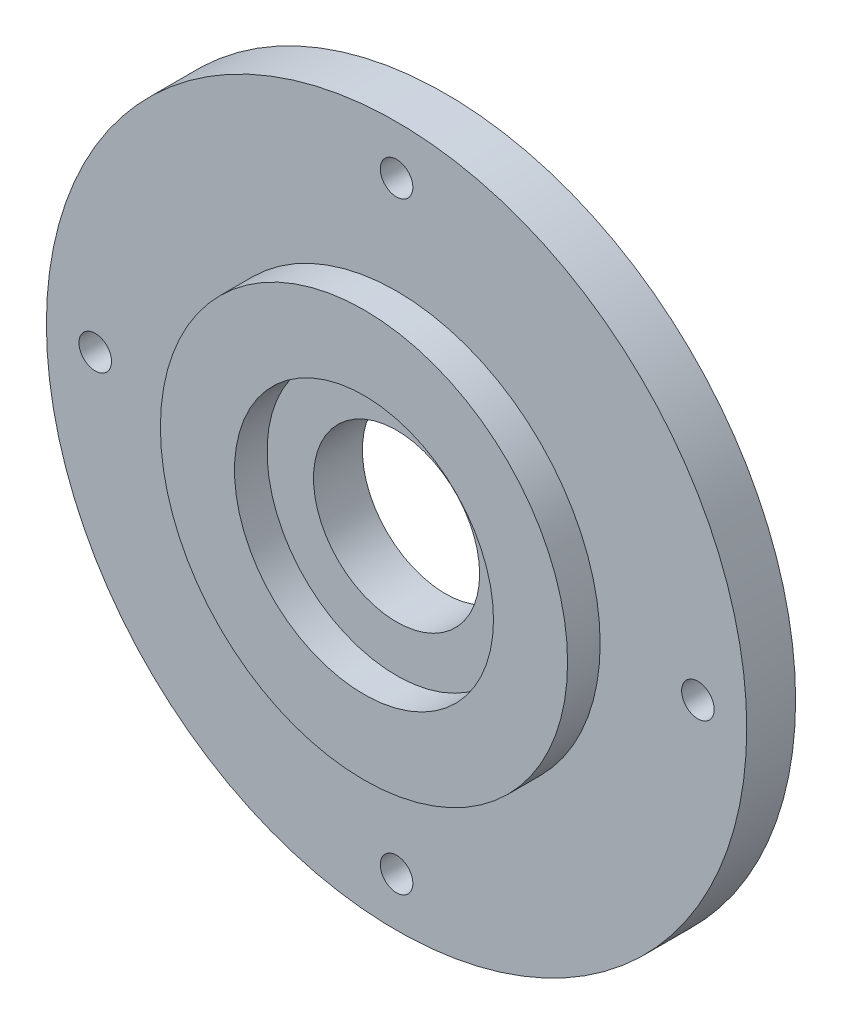
from build123d import *

# Parameters (mm, degrees)
SKETCH_1_R               = 41.5
SKETCH_1_R_2             = 2
SKETCH_1_R_3             = 10.2
EXTRUDE_1_DEPTH          = 6
CUT_EXTRUDE_1_DEPTH      = 59.99576256
CUT_EXTRUDE_1_DEPTH_BACK = 59.99576256
SKETCH_4_R               = 1.65
SKETCH_3_R               = 25
SKETCH_3_R_2             = 15.9
EXTRUDE_2_DEPTH          = 4
EXTRUDE_START            = -6
SKETCH_5_R               = 43
SKETCH_5_R_2             = 41.5
EXTRUDE_4_DEPTH          = 6


with BuildPart() as part:
    # 草图1 → 凸台-拉伸1 (new body)
    with BuildSketch(Plane.XY):
        Circle(SKETCH_1_R)
        with Locations((0, -37)):
            Circle(SKETCH_1_R_2, mode=Mode.SUBTRACT)
        with Locations((-37, 0)):
            Circle(SKETCH_1_R_2, mode=Mode.SUBTRACT)
        with Locations((0, 37)):
            Circle(SKETCH_1_R_2, mode=Mode.SUBTRACT)
        with Locations((37, 0)):
            Circle(SKETCH_1_R_2, mode=Mode.SUBTRACT)
        Circle(SKETCH_1_R_3, mode=Mode.SUBTRACT)
    extrude(amount=EXTRUDE_1_DEPTH)

    # 草图4 → 切除-拉伸1 (cut, two sides: drawn at the far end of the back side and taken through both)
    with BuildSketch(Plane(origin=(0, 0, 0), x_dir=(-1, 0, 0), z_dir=(0, 0, -1)).offset(-CUT_EXTRUDE_1_DEPTH_BACK)):
        with Locations((-19.798989873, 4.242640687)):
            Circle(SKETCH_4_R)
        with Locations((-4.242640687, 19.798989873)):
            Circle(SKETCH_4_R)
        with Locations((19.798989873, -4.242640687)):
            Circle(SKETCH_4_R)
        with Locations((4.242640687, -19.798989873)):
            Circle(SKETCH_4_R)
    extrude(amount=CUT_EXTRUDE_1_DEPTH + CUT_EXTRUDE_1_DEPTH_BACK, mode=Mode.SUBTRACT)

    # 草图3 → 凸台-拉伸2 (add)
    with BuildSketch(Plane.XY.offset(6)):
        Circle(SKETCH_3_R)
        Circle(SKETCH_3_R_2, mode=Mode.SUBTRACT)
    extrude(amount=EXTRUDE_2_DEPTH)

    # 草图5 → 凸台-拉伸4 (add)
    with BuildSketch(Plane.XY.offset(6).offset(EXTRUDE_START)):
        Circle(SKETCH_5_R)
        Circle(SKETCH_5_R_2, mode=Mode.SUBTRACT)
    extrude(amount=EXTRUDE_4_DEPTH)


solid = part.part
